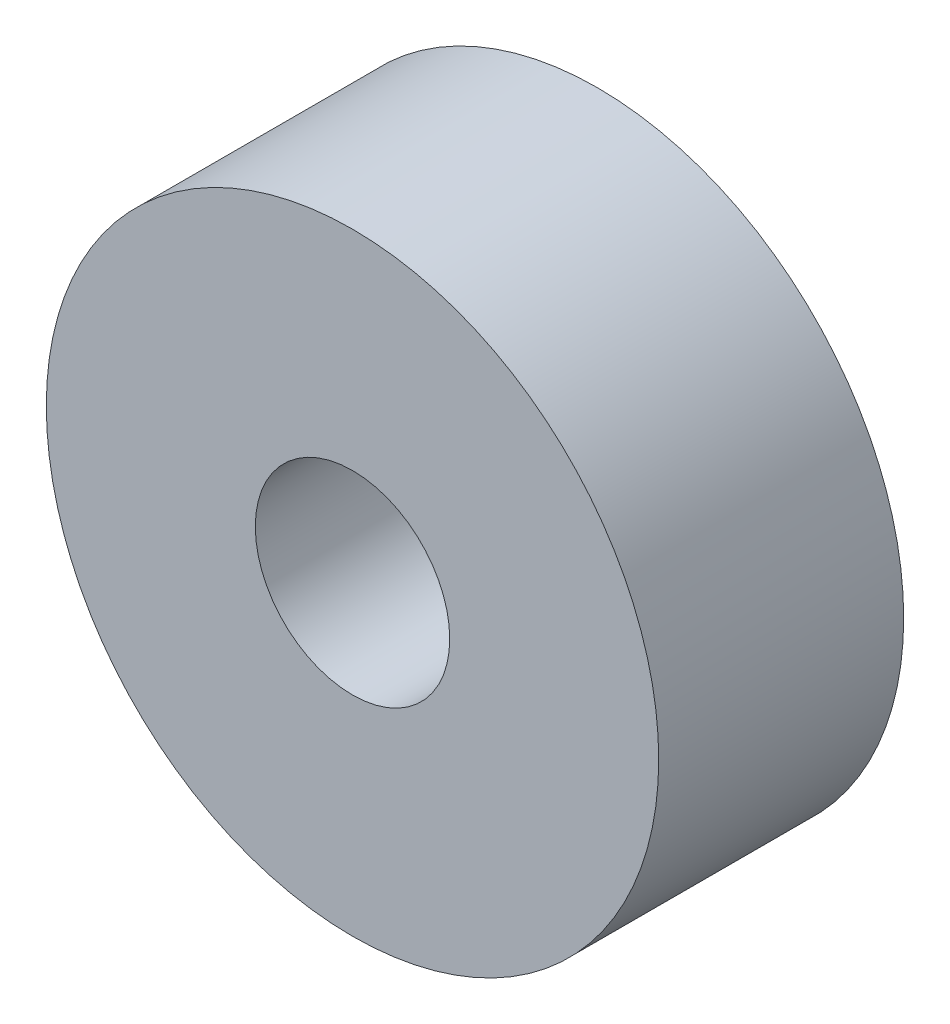
from build123d import *

# Parameters (mm, degrees)
SKETCH1_R           = 5
SKETCH1_R_2         = 1.5875
BOSS_EXTRUDE1_DEPTH = 4


with BuildPart() as part:
    # Sketch1 → Boss-Extrude1 (new body)
    with BuildSketch(Plane.XY):
        Circle(SKETCH1_R)
        Circle(SKETCH1_R_2, mode=Mode.SUBTRACT)
    extrude(amount=BOSS_EXTRUDE1_DEPTH)


solid = part.part
